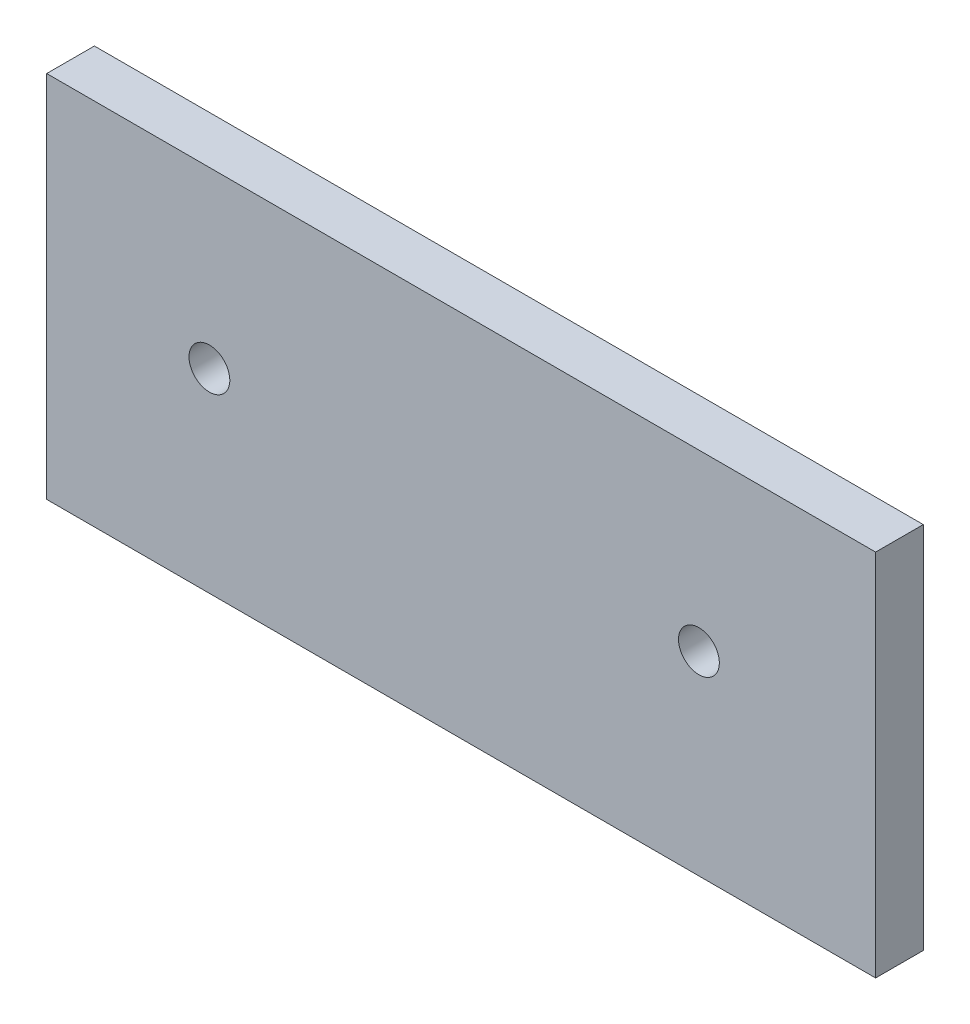
from build123d import *

# Parameters (mm, degrees)
SKETCH1_W                 = 101.6
SKETCH1_H                 = 45.212
BOSS_EXTRUDE1_DEPTH       = 5.842
M6X1_0_TAPPED_HOLE1_D     = 5
M6X1_0_TAPPED_HOLE1_DEPTH = 14.986
M6X1_0_TAPPED_HOLE1_TIP   = 1.502151548


with BuildPart() as part:
    # Sketch1 → Boss-Extrude1 (new body)
    with BuildSketch(Plane.XY):
        with Locations((-50.8, 22.606)):
            Rectangle(SKETCH1_W, SKETCH1_H)
    extrude(amount=BOSS_EXTRUDE1_DEPTH)

    # M6x1.0 Tapped Hole1
    with Locations(Plane(origin=(-50.8, -38.1, 0), x_dir=(-1, 0, 0), z_dir=(0, 0, -1))):
        with Locations((-29.14300736, 61.964884424), (30.859893074, 61.964884424)):
            Hole(M6X1_0_TAPPED_HOLE1_D / 2, depth=M6X1_0_TAPPED_HOLE1_DEPTH)
            with Locations((0, 0, -(M6X1_0_TAPPED_HOLE1_DEPTH + M6X1_0_TAPPED_HOLE1_TIP / 2))):  # 118° drill point
                Cone(0, M6X1_0_TAPPED_HOLE1_D / 2, M6X1_0_TAPPED_HOLE1_TIP, mode=Mode.SUBTRACT)


solid = part.part
